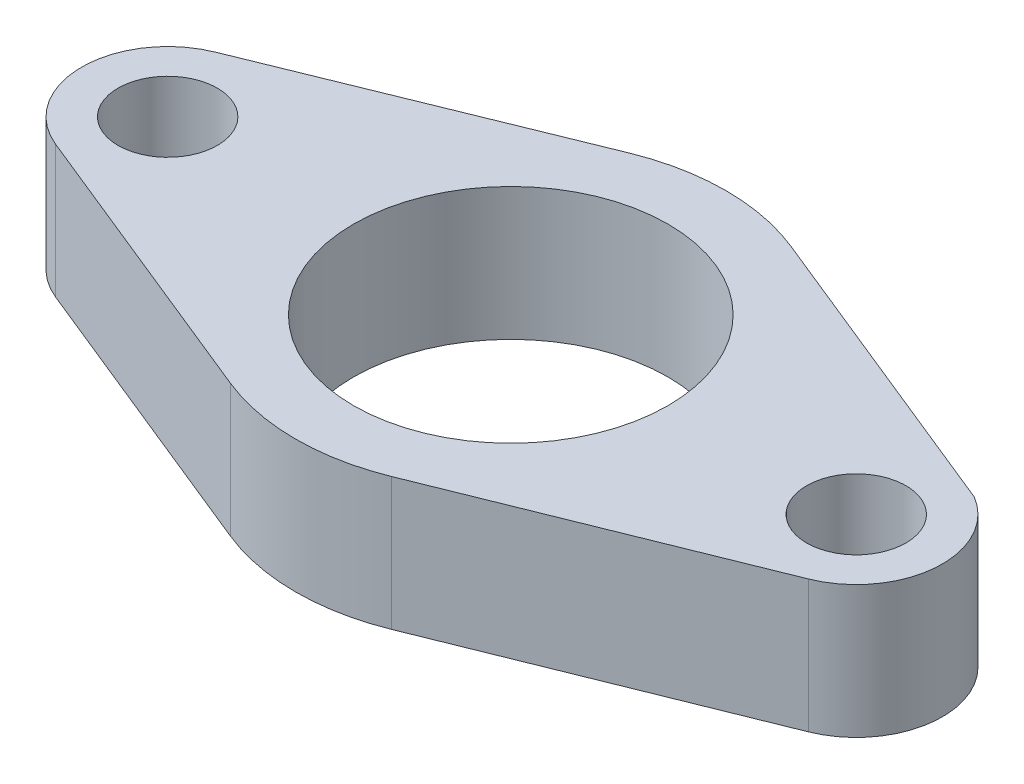
from build123d import *

# Parameters (mm, degrees)
SKETCH1_R           = 9.525
SKETCH1_R_2         = 30.1625
BOSS_EXTRUDE1_DEPTH = 12.7


with BuildPart() as part:
    # Sketch1 → Boss-Extrude1 (new, symmetric)
    with BuildSketch(Plane(origin=(0, 0, 0), x_dir=(1, 0, 0), z_dir=(0, 1, 0))):
        with BuildLine():
            Line((-15.533043632, 38.240687501), (-72.019726416, 15.296275))
            ThreePointArc((-72.019726416, 15.296275), (-82.316508964, 0), (-72.019726416, -15.296275))
            Line((-72.019726416, -15.296275), (-15.533043632, -38.240687501))
            ThreePointArc((-15.533043632, -38.240687501), (-0.059033228, -41.274957784), (15.423593341, -38.28496302))
            Line((15.423593341, -38.28496302), (72.442928372, -15.313985208))
            ThreePointArc((72.442928372, -15.313985208), (82.737758003, -1.228011915), (74.64645973, 14.229318158))
            Line((74.64645973, 14.229318158), (70.194684869, 16.037591432))
            Line((70.194684869, 16.037591432), (15.533043632, 38.240687501))
            ThreePointArc((15.533043632, 38.240687501), (0, 41.275), (-15.533043632, 38.240687501))
        make_face()
        with Locations((-65.806508964, 0)):
            Circle(SKETCH1_R, mode=Mode.SUBTRACT)
        Circle(SKETCH1_R_2, mode=Mode.SUBTRACT)
        with Locations((66.273491036, 0)):
            Circle(SKETCH1_R, mode=Mode.SUBTRACT)
    extrude(amount=BOSS_EXTRUDE1_DEPTH, both=True)


solid = part.part
